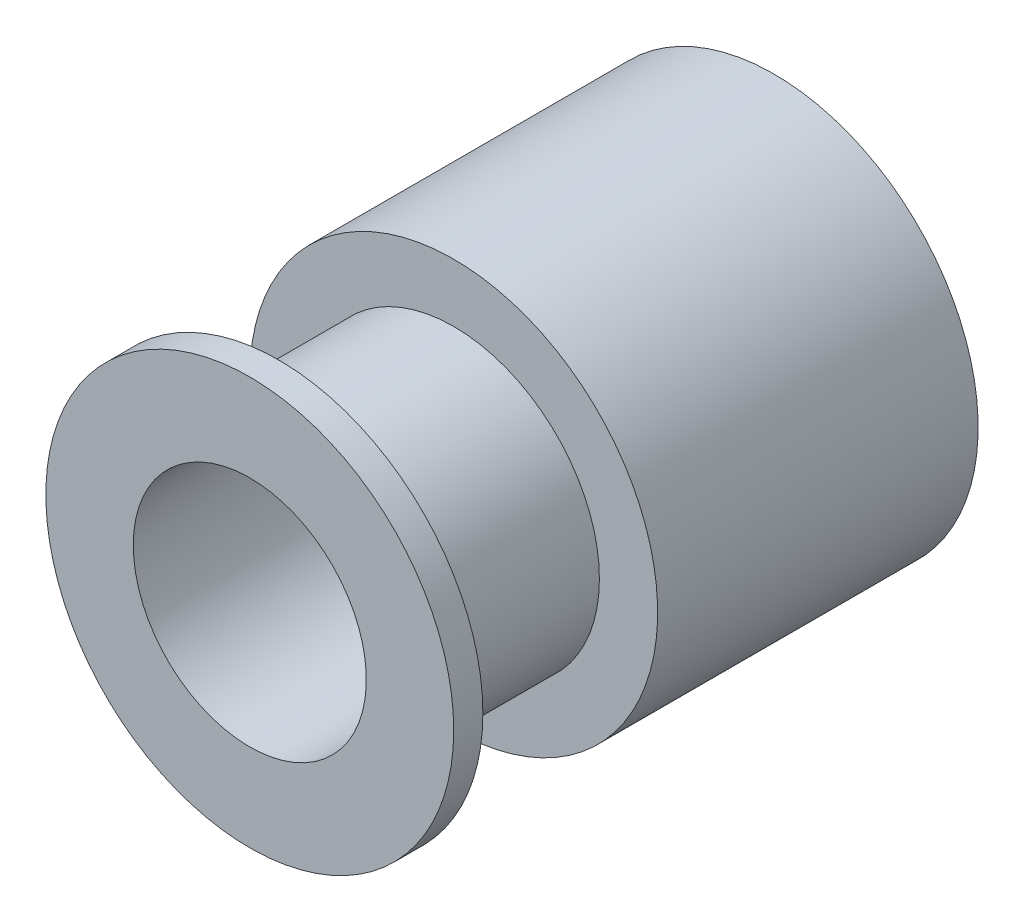
from build123d import *

# Parameters (mm, degrees)
SKETCH_1_R          = 7
EXTRUDE_1_DEPTH     = 1
SKETCH_2_R          = 5
EXTRUDE_2_DEPTH     = 6
EXTRUDE_START       = 11
SKETCH_3_R          = 7
EXTRUDE_3_DEPTH     = 11
SKETCH_4_R          = 4
CUT_EXTRUDE_1_DEPTH = 21.542638584


with BuildPart() as part:
    # Эскиз1 → Бобышка-Вытянуть1 (new body)
    with BuildSketch(Plane.XY):
        Circle(SKETCH_1_R)
    extrude(amount=EXTRUDE_1_DEPTH)

    # Эскиз2 → Бобышка-Вытянуть2 (add)
    with BuildSketch(Plane(origin=(0, 0, 0), x_dir=(-1, 0, 0), z_dir=(0, 0, -1))):
        with Locations(Location((0, 0, 0), (0, 0, 180))):
            Circle(SKETCH_2_R)
    extrude(amount=EXTRUDE_2_DEPTH)

    # Эскиз3 → Бобышка-Вытянуть3 (add)
    with BuildSketch(Plane(origin=(0, 0, -6), x_dir=(-1, 0, 0), z_dir=(0, 0, -1)).offset(EXTRUDE_START)):
        with Locations(Location((0, 0, 0), (0, 0, 180))):
            Circle(SKETCH_3_R)
    extrude(amount=-EXTRUDE_3_DEPTH)

    # Эскиз4 → Вырез-Вытянуть1 (cut, through all)
    with BuildSketch(Plane(origin=(0, 0, -17), x_dir=(-1, 0, 0), z_dir=(0, 0, -1))):
        Circle(SKETCH_4_R)
    extrude(amount=-CUT_EXTRUDE_1_DEPTH, mode=Mode.SUBTRACT)


solid = part.part
